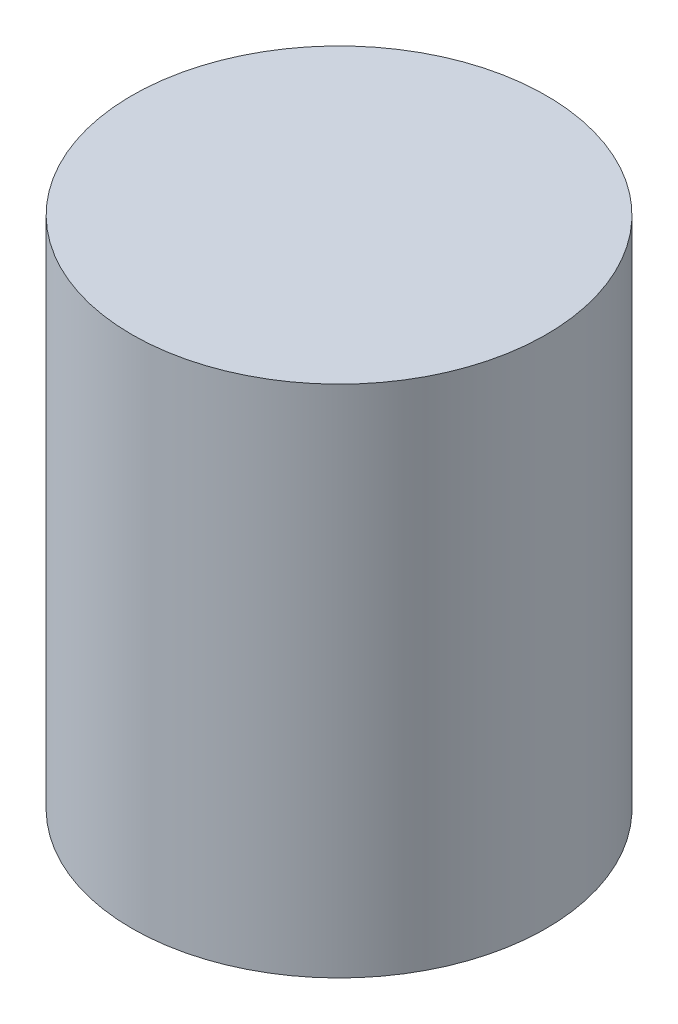
from build123d import *

# Parameters (mm, degrees)
SKETCH1_R            = 29
MOTOR_ENVELOPE_DEPTH = 72


with BuildPart() as part:
    # Sketch1 → Motor_Envelope (new body)
    with BuildSketch(Plane(origin=(0, 0, 0), x_dir=(1, 0, 0), z_dir=(0, 1, 0))):
        with Locations(Location((0, 0, 0), (0, 0, 270))):
            Circle(SKETCH1_R)
    extrude(amount=MOTOR_ENVELOPE_DEPTH)


solid = part.part
